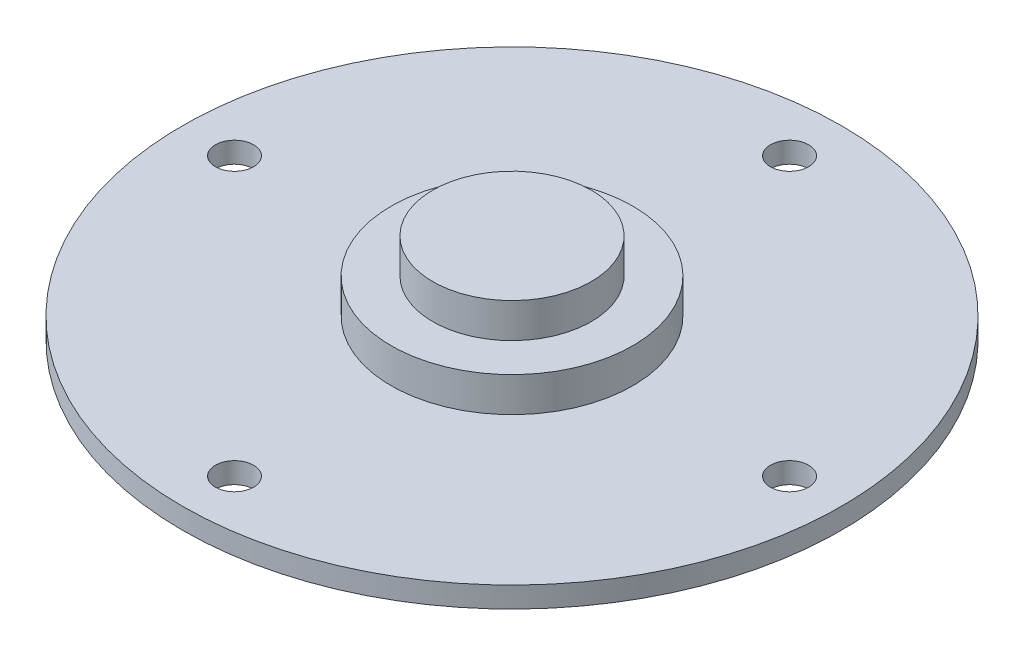
from build123d import *

# Parameters (mm, degrees)
M10_CLEARANCE_HOLE1_D = 11
CIRPATTERN1_COUNT     = 4


with BuildPart() as part:
    # Sketch5 → Revolve1 (revolve)
    with BuildSketch(Plane(origin=(0, 0, 0), x_dir=(0, 0, -1), z_dir=(1, 0, 0))):
        Polygon((34.85, 6), (95, 6), (95, 0), (0, 0), (0, 26), (22.85, 26), (22.85, 16), (34.85, 16), align=None)
    revolve(axis=Axis((0, 0, 0), (0, 1, 0)))

    # M10 Clearance Hole1 (through all)
    with Locations(Plane(origin=(0, 6, -80), x_dir=(0, 0, 1), z_dir=(0, 1, 0))):
        with Locations((0, 0)):
            m10_clearance_hole1 = Hole(M10_CLEARANCE_HOLE1_D / 2)

    # CirPattern1: M10 Clearance Hole1 ×4 about axis
    cirpattern1_axis = Axis((0, 0, 0), (0, 1, 0))
    for i in range(1, CIRPATTERN1_COUNT):
        add(m10_clearance_hole1.rotate(cirpattern1_axis, i * 360 / CIRPATTERN1_COUNT), mode=Mode.SUBTRACT)


solid = part.part
